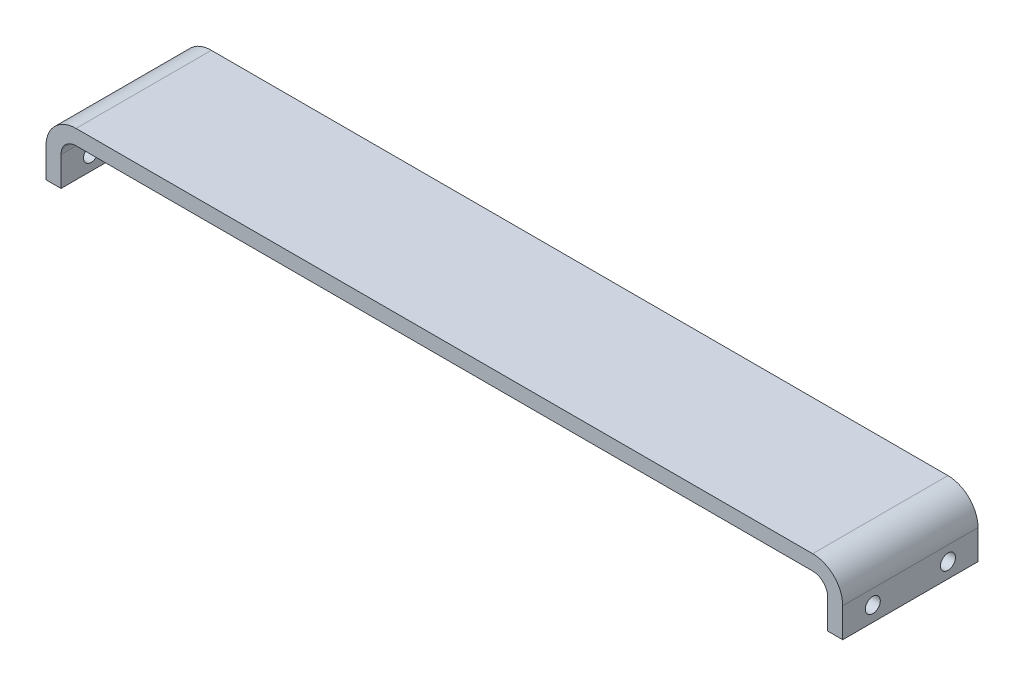
from build123d import *

# Parameters (mm, degrees)
BOSS_EXTRUDE2_DEPTH = 90
SKETCH2_R           = 5
CUT_EXTRUDE1_DEPTH  = 540.043745906


with BuildPart() as part:
    # Sketch1 → Boss-Extrude2 (new body)
    with BuildSketch(Plane.XY):
        with BuildLine():
            Line((20, 29.6), (510, 29.6))
            ThreePointArc((510, 29.6), (517.071067812, 26.671067812), (520, 19.6))
            Line((520, 19.6), (520, 0))
            Line((520, 0), (530, 0))
            Line((530, 0), (530, 19.6))
            ThreePointArc((530, 19.6), (524.142135624, 33.742135624), (510, 39.6))
            Line((510, 39.6), (20, 39.6))
            ThreePointArc((20, 39.6), (5.857864376, 33.742135624), (0, 19.6))
            Line((0, 19.6), (0, 0))
            Line((0, 0), (10, 0))
            Line((10, 0), (10, 19.6))
            ThreePointArc((10, 19.6), (12.928932188, 26.671067812), (20, 29.6))
        make_face()
    extrude(amount=BOSS_EXTRUDE2_DEPTH)

    # Sketch2 → Cut-Extrude1 (cut, through all)
    with BuildSketch(Plane.ZY):
        with Locations((20, 10)):
            Circle(SKETCH2_R)
        with Locations(Location((70, 10, 0), (0, 0, 180))):
            Circle(SKETCH2_R)
    extrude(amount=-CUT_EXTRUDE1_DEPTH, mode=Mode.SUBTRACT)


solid = part.part
